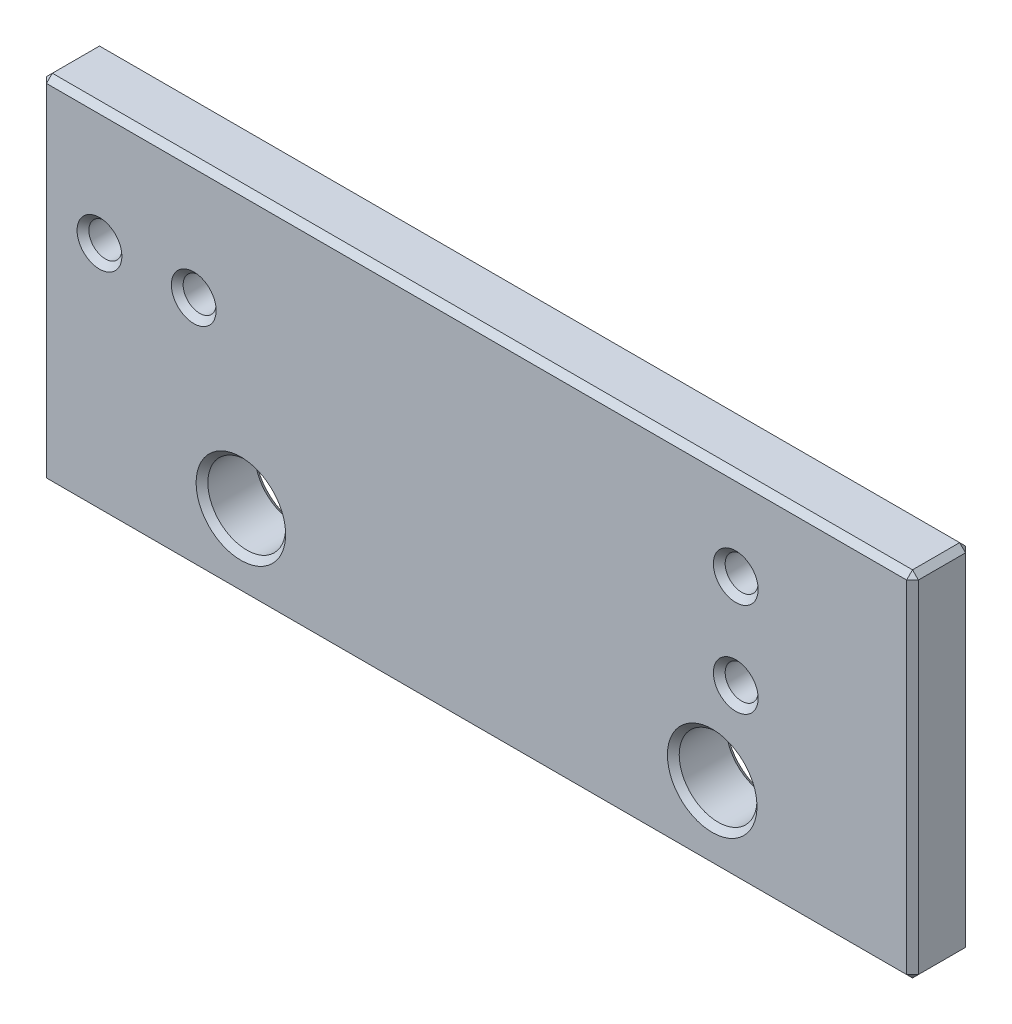
from build123d import *

# Parameters (mm, degrees)
SKETCH1_W            = 74
SKETCH1_H            = 30
BOSS_EXTRUDE1_DEPTH  = 5
M6_CLEARANCE_HOLE1_D = 6.6
SKETCH5_R            = 1.4
CUT_EXTRUDE1_DEPTH   = 5
SKETCH6_R            = 1.4
CUT_EXTRUDE2_DEPTH   = 5
CHAMFER1_SIZE        = 0.5


with BuildPart() as part:
    # Sketch1 → Boss-Extrude1 (new body)
    with BuildSketch(Plane.XY):
        with Locations((37, 15)):
            Rectangle(SKETCH1_W, SKETCH1_H)
    extrude(amount=BOSS_EXTRUDE1_DEPTH)

    # M6 Clearance Hole1 (through all)
    with Locations(Plane.XY.offset(5)):
        with Locations((17, 6.5), (57, 6.5)):
            Hole(M6_CLEARANCE_HOLE1_D / 2)

    # Sketch5 → Cut-Extrude1 (cut)
    with BuildSketch(Plane.XY.offset(5)):
        with Locations((59, 22.5)):
            Circle(SKETCH5_R)
        with Locations((59, 14.5)):
            Circle(SKETCH5_R)
    extrude(amount=-CUT_EXTRUDE1_DEPTH, mode=Mode.SUBTRACT)

    # Sketch6 → Cut-Extrude2 (cut)
    with BuildSketch(Plane.XY.offset(5)):
        with Locations((5, 20)):
            Circle(SKETCH6_R)
        with Locations((13, 20)):
            Circle(SKETCH6_R)
    extrude(amount=-CUT_EXTRUDE2_DEPTH, mode=Mode.SUBTRACT)

    # Chamfer1
    chamfer1_edges = [part.edges().sort_by_distance(p)[0] for p in [
        (74, 15, 5),
        (37, 30, 5),
        (60.3, 6.5, 5),
        (60.3, 6.5, 0),
        (20.3, 6.5, 5),
        (20.3, 6.5, 0),
        (0, 15, 5),
        (37, 30, 0),
        (74, 15, 0),
        (37, 0, 0),
        (0, 15, 0),
        (57.6, 22.5, 0),
        (57.6, 22.5, 5),
        (37, 0, 5),
        (57.6, 14.5, 0),
        (57.6, 14.5, 5),
        (0, 30, 2.5),
        (74, 30, 2.5),
        (74, 0, 2.5),
        (0, 0, 2.5),
        (3.6, 20, 0),
        (3.6, 20, 5),
        (11.6, 20, 0),
        (11.6, 20, 5),
    ]]
    chamfer(chamfer1_edges, length=CHAMFER1_SIZE)


solid = part.part
